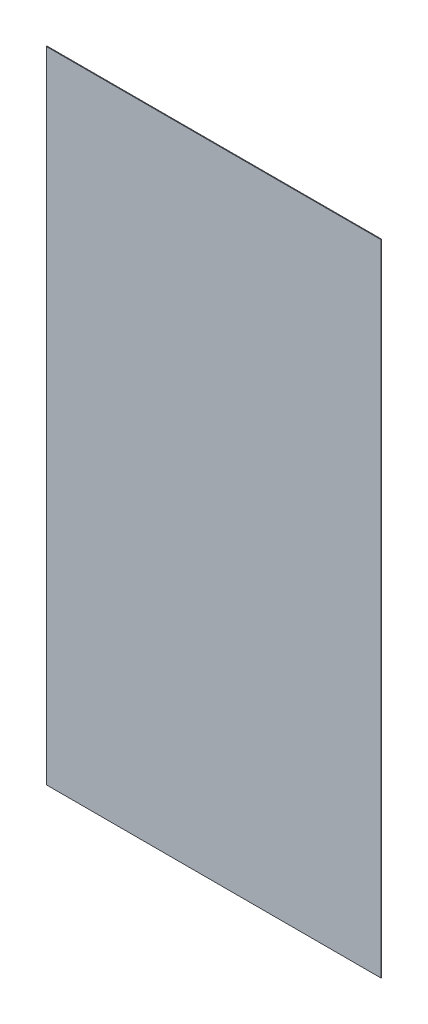
from build123d import *

# Parameters (mm, degrees)
SKETCH_2_W      = 450
SKETCH_2_H      = 860
EXTRUDE_1_DEPTH = 1


with BuildPart() as part:
    # 草图2 → 凸台-拉伸1 (new body)
    with BuildSketch(Plane.XY):
        with Locations((225, 430)):
            Rectangle(SKETCH_2_W, SKETCH_2_H)
    extrude(amount=EXTRUDE_1_DEPTH)


solid = part.part
